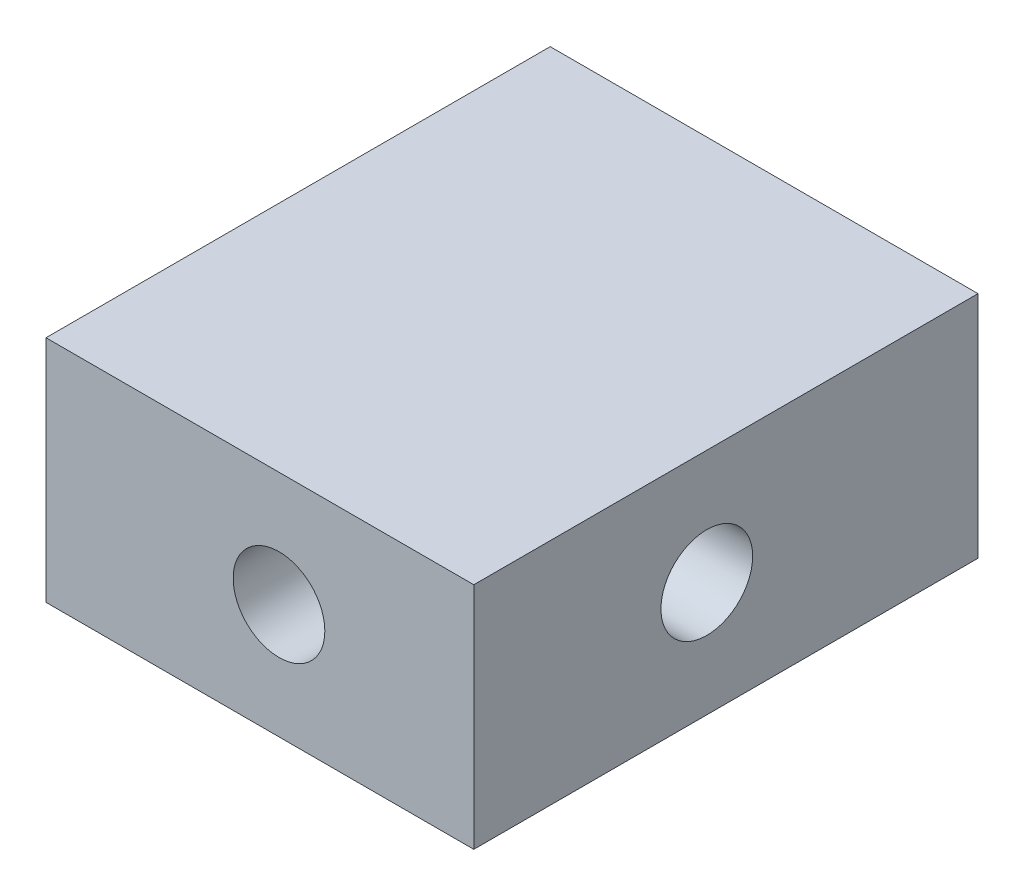
from build123d import *

# Parameters (mm, degrees)
SKETCH_1_W          = 28
SKETCH_1_H          = 33
EXTRUDE_1_DEPTH     = 15
SKETCH_2_R          = 3
CUT_EXTRUDE_1_DEPTH = 5
SKETCH_3_R          = 3
CUT_EXTRUDE_2_DEPTH = 5


with BuildPart() as part:
    # 草图1 → 凸台-拉伸1 (new body)
    with BuildSketch(Plane(origin=(0, 0, 0), x_dir=(1, 0, 0), z_dir=(0, 1, 0))):
        with Locations((14, -16.5)):
            Rectangle(SKETCH_1_W, SKETCH_1_H)
    extrude(amount=EXTRUDE_1_DEPTH)

    # 草图2 → 切除-拉伸1 (cut)
    with BuildSketch(Plane.XY.offset(33)):
        with Locations((15.25, 7.5)):
            Circle(SKETCH_2_R)
    extrude(amount=-CUT_EXTRUDE_1_DEPTH, mode=Mode.SUBTRACT)

    # 草图3 → 切除-拉伸2 (cut)
    with BuildSketch(Plane(origin=(28, 0, 0), x_dir=(0, 0, -1), z_dir=(1, 0, 0))):
        with Locations((-17.75, 7.5)):
            Circle(SKETCH_3_R)
    extrude(amount=-CUT_EXTRUDE_2_DEPTH, mode=Mode.SUBTRACT)


solid = part.part
